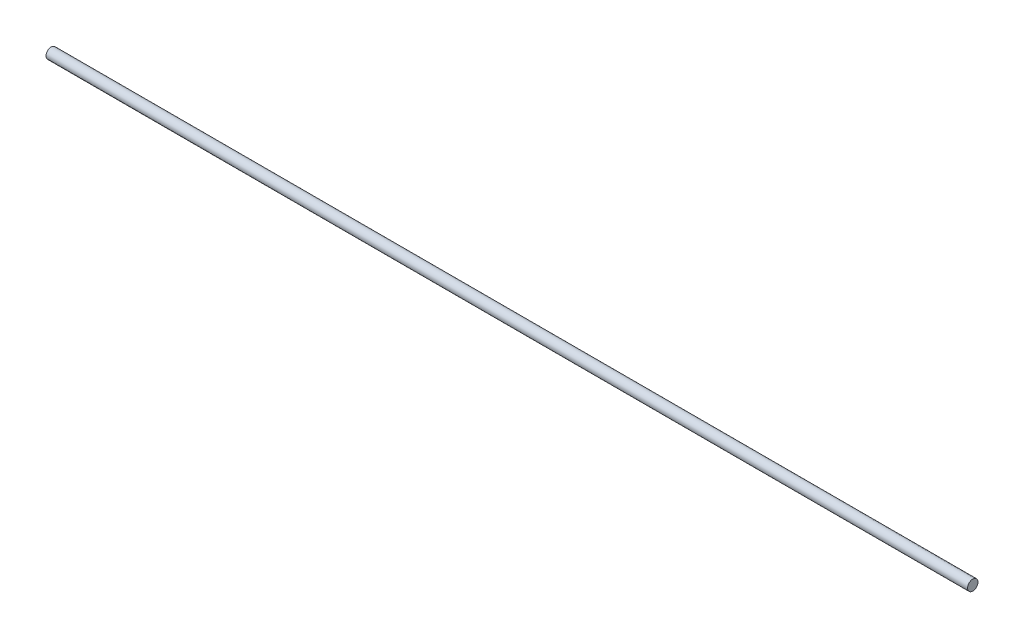
from build123d import *

# Parameters (mm, degrees)
SKETCH1_R           = 6.35
BOSS_EXTRUDE1_DEPTH = 1122.172


with BuildPart() as part:
    # Sketch1 → Boss-Extrude1 (new body)
    with BuildSketch(Plane(origin=(0, 0, 0), x_dir=(0, 0, -1), z_dir=(1, 0, 0))):
        Circle(SKETCH1_R)
    extrude(amount=BOSS_EXTRUDE1_DEPTH)


solid = part.part
